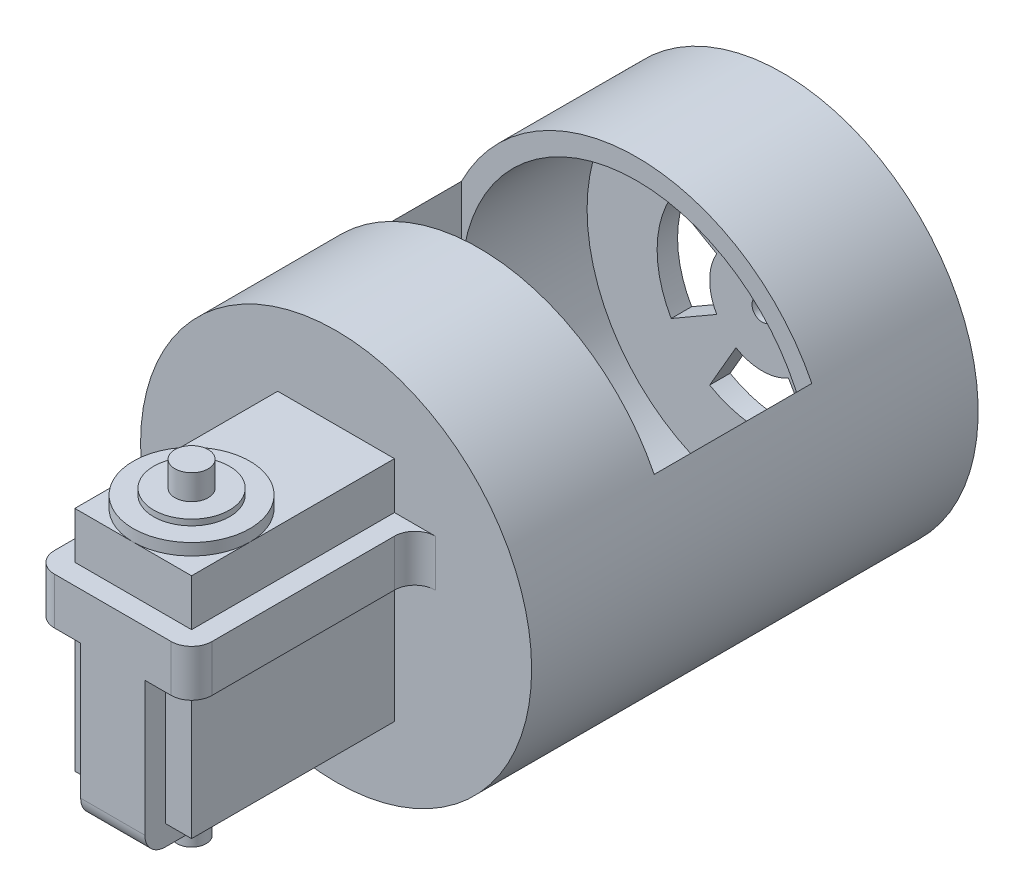
from build123d import *

# Parameters (mm, degrees)
SKETCH1_R            = 33.5
BOSS_EXTRUDE3_DEPTH  = 16.5
SKETCH2_W            = 20
SKETCH2_H            = 39
BOSS_EXTRUDE4_DEPTH  = 34.758
SKETCH3_R            = 10
SKETCH3_R_2          = 6.5
BOSS_EXTRUDE5_DEPTH  = 2
SKETCH3_3_R          = 6.5
BOSS_EXTRUDE6_DEPTH  = 3
SKETCH3_4_R          = 2.85
BOSS_EXTRUDE7_DEPTH  = 7.3
SKETCH5_W            = 11
SKETCH5_H            = 3.5
SKETCH5_W_2          = 3.5
SKETCH5_H_2          = 8
BOSS_EXTRUDE8_DEPTH  = 34.758
SKETCH6_W            = 11
SKETCH6_H            = 8
BOSS_EXTRUDE9_DEPTH  = 3.5
SKETCH7_R            = 2.5
BOSS_EXTRUDE10_DEPTH = 6
FILLET1_R            = 3.5
FILLET2_R            = 3.5
FILLET3_R            = 3.5
FILLET4_R            = 3.5
CUT_EXTRUDE11_DEPTH  = 3.5
CIRPATTERN4_COUNT    = 4
SKETCH14_3_R         = 1.25
CUT_EXTRUDE12_DEPTH  = 3.5
BOSS_EXTRUDE15_START = 60
SKETCH16_R           = 33.5
SKETCH16_R_2         = 30
BOSS_EXTRUDE15_DEPTH = 60
SKETCH17_W           = 60
SKETCH17_H           = 27
CUT_EXTRUDE13_DEPTH  = 33.5
SKETCH18_R           = 33.5
BOSS_EXTRUDE16_DEPTH = 3.5
CUT_EXTRUDE14_DEPTH  = 3.5
CIRPATTERN5_COUNT    = 4
CUT_EXTRUDE15_DEPTH  = 3.5


with BuildPart() as part:
    # Sketch1 → Boss-Extrude3 (new body)
    with BuildSketch(Plane.XY):
        Circle(SKETCH1_R)
    extrude(amount=BOSS_EXTRUDE3_DEPTH)

    # Sketch2 → Boss-Extrude4 (add)
    with BuildSketch(Plane.XY.offset(16.5)):
        Rectangle(SKETCH2_W, SKETCH2_H)
    extrude(amount=BOSS_EXTRUDE4_DEPTH)

    # Sketch3 → Boss-Extrude5 (add)
    with BuildSketch(Plane(origin=(0, 19.5, 0), x_dir=(1, 0, 0), z_dir=(0, 1, 0))):
        with Locations(Location((0, -41.258, 0), (0, 0, 270))):
            Circle(SKETCH3_R)
        with Locations(Location((0, -41.258, 0), (0, 0, 270))):
            Circle(SKETCH3_R_2, mode=Mode.SUBTRACT)
    extrude(amount=BOSS_EXTRUDE5_DEPTH)

    # Sketch3<3> → Boss-Extrude6 (add)
    with BuildSketch(Plane(origin=(0, 19.5, 0), x_dir=(1, 0, 0), z_dir=(0, 1, 0))):
        with Locations(Location((0, -41.258, 0), (0, 0, 270))):
            Circle(SKETCH3_3_R)
    extrude(amount=BOSS_EXTRUDE6_DEPTH)

    # Sketch3<4> → Boss-Extrude7 (add)
    with BuildSketch(Plane(origin=(0, 19.5, 0), x_dir=(1, 0, 0), z_dir=(0, 1, 0))):
        with Locations(Location((0, -41.258, 0), (0, 0, 270))):
            Circle(SKETCH3_4_R)
    extrude(amount=BOSS_EXTRUDE7_DEPTH)

    # Sketch5 → Boss-Extrude8 (add)
    with BuildSketch(Plane.XY.offset(51.258)):
        with Locations((0, -21.25)):
            Rectangle(SKETCH5_W, SKETCH5_H)
        with Locations((11.75, 7.5)):
            Rectangle(SKETCH5_W_2, SKETCH5_H_2)
        with Locations((-11.75, 7.5)):
            Rectangle(SKETCH5_W_2, SKETCH5_H_2)
    extrude(amount=-BOSS_EXTRUDE8_DEPTH)

    # Sketch6 → Boss-Extrude9 (add)
    with BuildSketch(Plane.XY.offset(51.258)):
        with Locations((0, 7.5)):
            Rectangle(SKETCH6_W, SKETCH6_H)
        Polygon((10, 11.5), (5.5, 11.5), (5.5, 3.5), (10, 3.5), (13.5, 3.5), (13.5, 11.5), align=None)
        Polygon((5.5, 3.5), (-5.5, 3.5), (-5.5, -19.5), (-5.5, -23), (5.5, -23), (5.5, -19.5), align=None)
        Polygon((-10, 11.5), (-13.5, 11.5), (-13.5, 3.5), (-10, 3.5), (-5.5, 3.5), (-5.5, 11.5), align=None)
    extrude(amount=BOSS_EXTRUDE9_DEPTH)

    # Sketch7 → Boss-Extrude10 (add)
    with BuildSketch(Plane.XZ.offset(23)):
        with Locations(Location((0, 41.258, 0), (0, 0, 270))):
            Circle(SKETCH7_R)
    extrude(amount=BOSS_EXTRUDE10_DEPTH)

    # Fillet1
    fillet1_edges = [part.edges().sort_by_distance(p)[0] for p in [
        (-13.5, 7.5, 54.758),
        (13.5, 7.5, 54.758),
    ]]
    fillet(fillet1_edges, radius=FILLET1_R)

    # Fillet2
    fillet2_edges = [part.edges().sort_by_distance(p)[0] for p in [
        (0, -23, 54.758),
    ]]
    fillet(fillet2_edges, radius=FILLET2_R)

    # Fillet3
    fillet3_edges = [part.edges().sort_by_distance(p)[0] for p in [
        (13.5, 7.5, 16.5),
    ]]
    fillet(fillet3_edges, radius=FILLET3_R)

    # Fillet4
    fillet4_edges = [part.edges().sort_by_distance(p)[0] for p in [
        (-13.5, 7.5, 16.5),
    ]]
    fillet(fillet4_edges, radius=FILLET4_R)

    # Sketch14 → Cut-Extrude11 (cut)
    with BuildSketch(Plane(origin=(0, 0, 0), x_dir=(-1, 0, 0), z_dir=(0, 0, -1))):
        with BuildLine():
            Line((0, 18), (0, 9))
            ThreePointArc((0, 9), (2.329371406, 8.693332437), (4.5, 7.794228634))
            Line((4.5, 7.794228634), (9, 15.588457268))
            ThreePointArc((9, 15.588457268), (4.658742812, 17.386664873), (0, 18))
        make_face()
        with BuildLine():
            ThreePointArc((-4.5, 7.794228634), (-2.329371406, 8.693332437), (0, 9))
            Line((0, 9), (0, 18))
            ThreePointArc((0, 18), (-4.658742812, 17.386664873), (-9, 15.588457268))
            Line((-9, 15.588457268), (-4.5, 7.794228634))
        make_face()
    cut_extrude11 = extrude(amount=-CUT_EXTRUDE11_DEPTH, mode=Mode.SUBTRACT)

    # CirPattern4: Cut-Extrude11 ×4 about axis
    cirpattern4_axis = Axis((0, 0, 0), (0, 0, 1))
    for i in range(1, CIRPATTERN4_COUNT):
        add(cut_extrude11.rotate(cirpattern4_axis, i * 360 / CIRPATTERN4_COUNT), mode=Mode.SUBTRACT)

    # Sketch14<3> → Cut-Extrude12 (cut)
    with BuildSketch(Plane(origin=(0, 0, 0), x_dir=(-1, 0, 0), z_dir=(0, 0, -1))):
        Circle(SKETCH14_3_R)
    extrude(amount=-CUT_EXTRUDE12_DEPTH, mode=Mode.SUBTRACT)

    # Sketch16 → Boss-Extrude15 (add)
    with BuildSketch(Plane(origin=(0, 0, 0), x_dir=(-1, 0, 0), z_dir=(0, 0, -1)).offset(BOSS_EXTRUDE15_START)):
        Circle(SKETCH16_R)
        Circle(SKETCH16_R_2, mode=Mode.SUBTRACT)
    extrude(amount=-BOSS_EXTRUDE15_DEPTH)

    # Sketch17 → Cut-Extrude13 (cut)
    with BuildSketch(Plane(origin=(0, 33.5, 0), x_dir=(1, 0, 0), z_dir=(0, 1, 0))):
        with Locations((0, 21.5)):
            Rectangle(SKETCH17_W, SKETCH17_H)
    extrude(amount=-CUT_EXTRUDE13_DEPTH, mode=Mode.SUBTRACT)

    # Sketch18 → Boss-Extrude16 (add)
    with BuildSketch(Plane(origin=(0, 0, -60), x_dir=(-1, 0, 0), z_dir=(0, 0, -1))):
        Circle(SKETCH18_R)
    extrude(amount=-BOSS_EXTRUDE16_DEPTH)

    # Sketch18<3> → Cut-Extrude14 (cut)
    with BuildSketch(Plane(origin=(0, 0, -60), x_dir=(-1, 0, 0), z_dir=(0, 0, -1))):
        with BuildLine():
            ThreePointArc((-4.5, 7.794228634), (-2.329371406, 8.693332437), (0, 9))
            Line((0, 9), (0, 18))
            ThreePointArc((0, 18), (-4.658742812, 17.386664873), (-9, 15.588457268))
            Line((-9, 15.588457268), (-4.5, 7.794228634))
        make_face()
        with BuildLine():
            Line((0, 18), (0, 9))
            ThreePointArc((0, 9), (2.329371406, 8.693332437), (4.5, 7.794228634))
            Line((4.5, 7.794228634), (9, 15.588457268))
            ThreePointArc((9, 15.588457268), (4.658742812, 17.386664873), (0, 18))
        make_face()
    cut_extrude14 = extrude(amount=-CUT_EXTRUDE14_DEPTH, mode=Mode.SUBTRACT)

    # CirPattern5: Cut-Extrude14 ×4 about axis
    cirpattern5_axis = Axis((0, 0, 16.5), (0, 0, -1))
    for i in range(1, CIRPATTERN5_COUNT):
        add(cut_extrude14.rotate(cirpattern5_axis, i * 360 / CIRPATTERN5_COUNT), mode=Mode.SUBTRACT)

    # Sketch18<4> → Cut-Extrude15 (cut)
    with BuildSketch(Plane(origin=(0, 0, -60), x_dir=(-1, 0, 0), z_dir=(0, 0, -1))):
        with BuildLine():
            Line((0, 1.75), (0, 0))
            Line((0, 0), (0.875, 1.515544457))
            ThreePointArc((0.875, 1.515544457), (0.452933329, 1.690370196), (0, 1.75))
        make_face()
        with BuildLine():
            Line((-0.875, 1.515544457), (0, 0))
            Line((0, 0), (0, 1.75))
            ThreePointArc((0, 1.75), (-0.452933329, 1.690370196), (-0.875, 1.515544457))
        make_face()
        with BuildLine():
            Line((0.875, 1.515544457), (0, 0))
            Line((0, 0), (-0.875, 1.515544457))
            ThreePointArc((-0.875, 1.515544457), (-0.875, -1.515544457), (1.75, 0))
            ThreePointArc((1.75, 0), (1.515544457, 0.875), (0.875, 1.515544457))
        make_face()
    extrude(amount=-CUT_EXTRUDE15_DEPTH, mode=Mode.SUBTRACT)


solid = part.part
